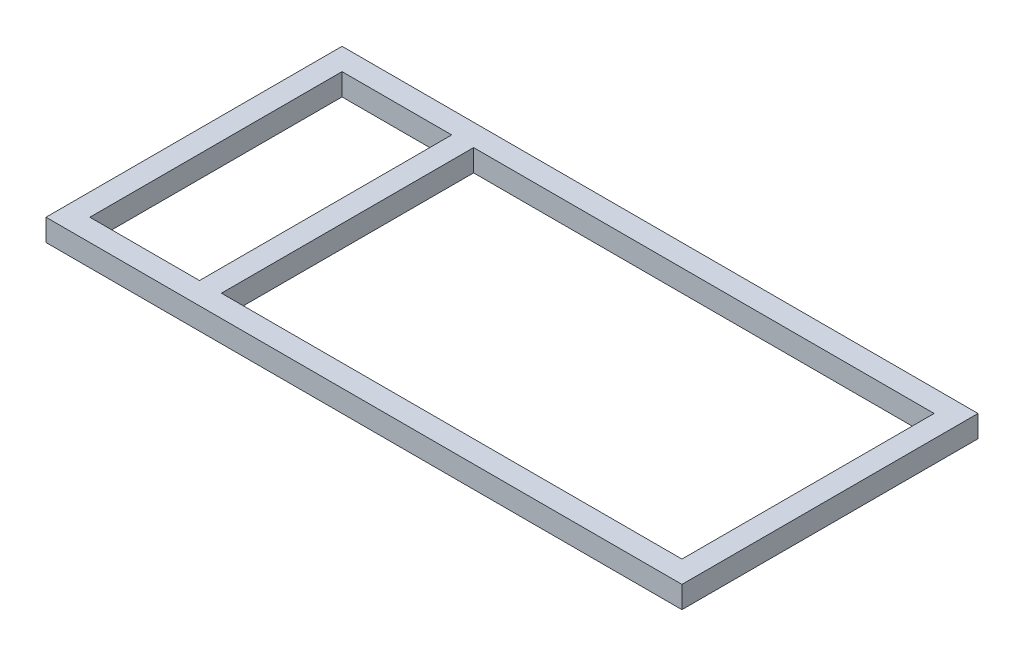
from build123d import *

# Parameters (mm, degrees)
SKETCH1_W           = 736.6
SKETCH1_H           = 342.9
SKETCH1_W_2         = 127
SKETCH1_H_2         = 292.1
SKETCH1_W_3         = 533.4
BOSS_EXTRUDE1_DEPTH = 25.4


with BuildPart() as part:
    # Sketch1 → Boss-Extrude1 (new body)
    with BuildSketch(Plane(origin=(0, 0, 0), x_dir=(1, 0, 0), z_dir=(0, 1, 0))):
        with Locations((368.3, 171.45)):
            Rectangle(SKETCH1_W, SKETCH1_H)
        with Locations((88.9, 171.45)):
            Rectangle(SKETCH1_W_2, SKETCH1_H_2, mode=Mode.SUBTRACT)
        with Locations((444.5, 171.45)):
            Rectangle(SKETCH1_W_3, SKETCH1_H_2, mode=Mode.SUBTRACT)
    extrude(amount=BOSS_EXTRUDE1_DEPTH)


solid = part.part
